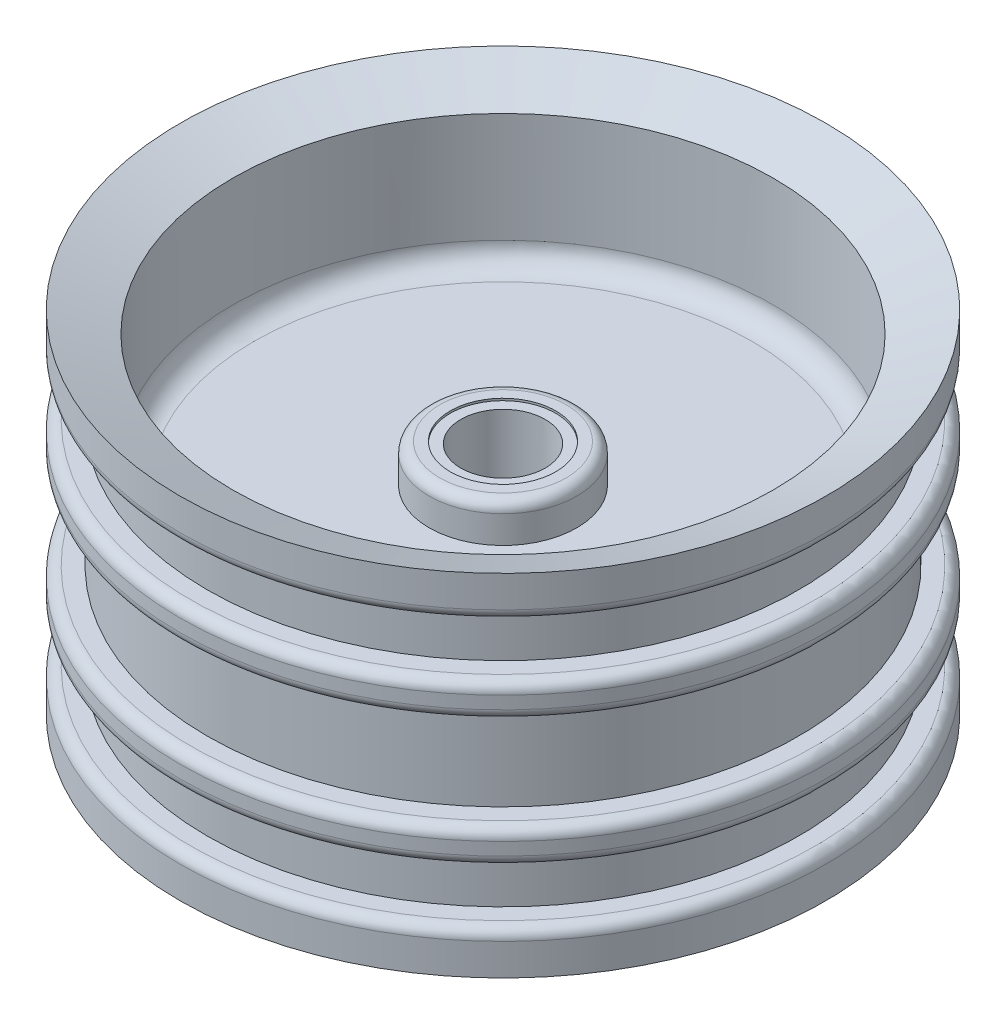
from build123d import *

# Parameters (mm, degrees)
SKETCH_1_R          = 14
EXTRUDE_1_DEPTH     = 16.6
SKETCH_3_R          = 12.8
CUT_EXTRUDE_1_DEPTH = 7.2
CUT_EXTRUDE_START   = -7.8
SKETCH_4_R          = 12.8
CUT_EXTRUDE_2_DEPTH = 7.8
SKETCH_6_R          = 3.5
EXTRUDE_2_DEPTH     = 1.8
SKETCH_7_R          = 2.5
CUT_EXTRUDE_3_DEPTH = 0.1
SKETCH_8_R          = 5
EXTRUDE_3_DEPTH     = 7.5
SKETCH_11_R         = 3.5
SKETCH_10_R         = 4.25
SKETCH_12_W         = 14
SKETCH_12_H         = 1
CUT_EXTRUDE_4_DEPTH = 12.5
CUT_EXTRUDE_5_DEPTH = 12.5
SKETCH_14_R         = 2
CUT_EXTRUDE_6_DEPTH = 27.792163206
FILLET_1_R          = 1
FILLET_2_R          = 0.5


with BuildPart() as part:
    # 草图1 → 凸台-拉伸1 (new body)
    with BuildSketch(Plane(origin=(0, 0, 0), x_dir=(1, 0, 0), z_dir=(0, 1, 0))):
        with Locations(Location((0, 0, 0), (0, 0, 90))):
            Circle(SKETCH_1_R)
    extrude(amount=EXTRUDE_1_DEPTH)

    # 草图2 → 旋转1 (revolve)
    with BuildSketch(Plane.XY, mode=Mode.PRIVATE) as revolve_1_sk:
        with BuildLine():
            Line((15.3, 0), (15.3, 1.5))
            ThreePointArc((15.3, 1.5), (15.153553391, 1.853553391), (14.8, 2))
            Line((14.8, 2), (14, 2))
            Line((14, 2), (14, 0))
            Line((14, 0), (15.3, 0))
        make_face()
        with BuildLine():
            Line((14, 6.1), (14, 4.5))
            Line((14, 4.5), (14.8, 4.5))
            ThreePointArc((14.8, 4.5), (15.153553391, 4.646446609), (15.3, 5))
            Line((15.3, 5), (15.3, 5.6))
            ThreePointArc((15.3, 5.6), (15.153553391, 5.953553391), (14.8, 6.1))
            Line((14.8, 6.1), (14, 6.1))
        make_face()
        with BuildLine():
            Line((14, 16.6), (15.3, 16.6))
            Line((15.3, 16.6), (15.3, 15.1))
            ThreePointArc((15.3, 15.1), (15.153553391, 14.746446609), (14.8, 14.6))
            Line((14.8, 14.6), (14, 14.6))
            Line((14, 14.6), (14, 16.6))
        make_face()
        with BuildLine():
            Line((15.3, 11.6), (15.3, 11))
            ThreePointArc((15.3, 11), (15.153553391, 10.646446609), (14.8, 10.5))
            Line((14.8, 10.5), (14, 10.5))
            Line((14, 10.5), (14, 12.1))
            Line((14, 12.1), (14.8, 12.1))
            ThreePointArc((14.8, 12.1), (15.153553391, 11.953553391), (15.3, 11.6))
        make_face()
    revolve(revolve_1_sk.sketch.rotate(Axis((0, 8.3, 0), (0, 1, 0)), 90), axis=Axis((0, 8.3, 0), (0, 1, 0)))

    # 草图3 → 切除-拉伸1 (cut)
    with BuildSketch(Plane(origin=(0, 16.6, 0), x_dir=(1, 0, 0), z_dir=(0, 1, 0))):
        with Locations(Location((0, 0, 0), (0, 0, 270))):
            Circle(SKETCH_3_R)
    extrude(amount=-CUT_EXTRUDE_1_DEPTH, mode=Mode.SUBTRACT)

    # 草图4 → 切除-拉伸2 (cut)
    with BuildSketch(Plane.XZ.offset(CUT_EXTRUDE_START)):
        with Locations(Location((0, 0, 0), (0, 0, 90))):
            Circle(SKETCH_4_R)
    extrude(amount=CUT_EXTRUDE_2_DEPTH, mode=Mode.SUBTRACT)

    # 草图5 → 切除-旋转1 (revolve, cut)
    with BuildSketch(Plane(origin=(0, 0, 0), x_dir=(0, 0, -1), z_dir=(1, 0, 0))):
        Polygon((15.3, 16.6), (12.8, 16.6), (12.8, 15.6), align=None)
        Polygon((12.8, 0), (12.8, 1), (15.3, 0), align=None)
    revolve(axis=Axis((0, 8.3, 0), (0, 1, 0)), mode=Mode.SUBTRACT)

    # 草图6 → 凸台-拉伸2 (add)
    with BuildSketch(Plane(origin=(0, 9.4, 0), x_dir=(1, 0, 0), z_dir=(0, 1, 0))):
        with Locations(Location((0, 0, 0), (0, 0, 270))):
            Circle(SKETCH_6_R)
    extrude(amount=EXTRUDE_2_DEPTH)

    # 草图7 → 切除-拉伸3 (cut)
    with BuildSketch(Plane(origin=(0, 11.2, 0), x_dir=(1, 0, 0), z_dir=(0, 1, 0))):
        with Locations(Location((0, 0, 0), (0, 0, 270))):
            Circle(SKETCH_7_R)
    extrude(amount=-CUT_EXTRUDE_3_DEPTH, mode=Mode.SUBTRACT)

    # 草图8 → 凸台-拉伸3 (add)
    with BuildSketch(Plane.XZ.offset(-7.8)):
        with Locations(Location((0, 0, 0), (0, 0, 270))):
            Circle(SKETCH_8_R)
    extrude(amount=EXTRUDE_3_DEPTH)

    # 草图11 → 放样1 section 0
    with BuildSketch(Plane(origin=(0, -4.7, 0), x_dir=(-1, 0, 0), z_dir=(0, -1, 0))):
        Circle(SKETCH_11_R)
    # 草图10 → 放样1 section 1
    with BuildSketch(Plane.XZ.offset(-0.3)):
        Circle(SKETCH_10_R)
    loft()

    # 草图12 → 切除-拉伸4 (cut)
    with BuildSketch(Plane.XZ.offset(4.7)):
        Rectangle(SKETCH_12_W, SKETCH_12_H)
    extrude(amount=-CUT_EXTRUDE_4_DEPTH, mode=Mode.SUBTRACT)

    # 草图13 → 切除-拉伸5 (cut)
    with BuildSketch(Plane.XZ.offset(4.7)):
        with BuildLine():
            Line((0.486486486, -3.566977838), (0.486486486, 3.566977838))
            ThreePointArc((0.486486486, 3.566977838), (-0.006821084, 3.599993538), (-0.5, 3.565108694))
            Line((-0.5, 3.565108694), (-0.5, -3.565108694))
            ThreePointArc((-0.5, -3.565108694), (-0.006821084, -3.599993538), (0.486486486, -3.566977838))
        make_face()
    extrude(amount=-CUT_EXTRUDE_5_DEPTH, mode=Mode.SUBTRACT)

    # 草图14 → 切除-拉伸6 (cut, through all)
    with BuildSketch(Plane(origin=(0, 11.1, 0), x_dir=(1, 0, 0), z_dir=(0, 1, 0))):
        with Locations(Location((0, 0, 0), (0, 0, 270))):
            Circle(SKETCH_14_R)
    extrude(amount=-CUT_EXTRUDE_6_DEPTH, mode=Mode.SUBTRACT)

    # 圆角1
    fillet_1_edges = [part.edges().sort_by_distance(p)[0] for p in [
        (0, 9.4, -12.8),
        (0, 7.8, -12.8),
    ]]
    fillet(fillet_1_edges, radius=FILLET_1_R)

    # 圆角2
    fillet_2_edges = [part.edges().sort_by_distance(p)[0] for p in [
        (0, 11.2, -3.5),
    ]]
    fillet(fillet_2_edges, radius=FILLET_2_R)


solid = part.part
